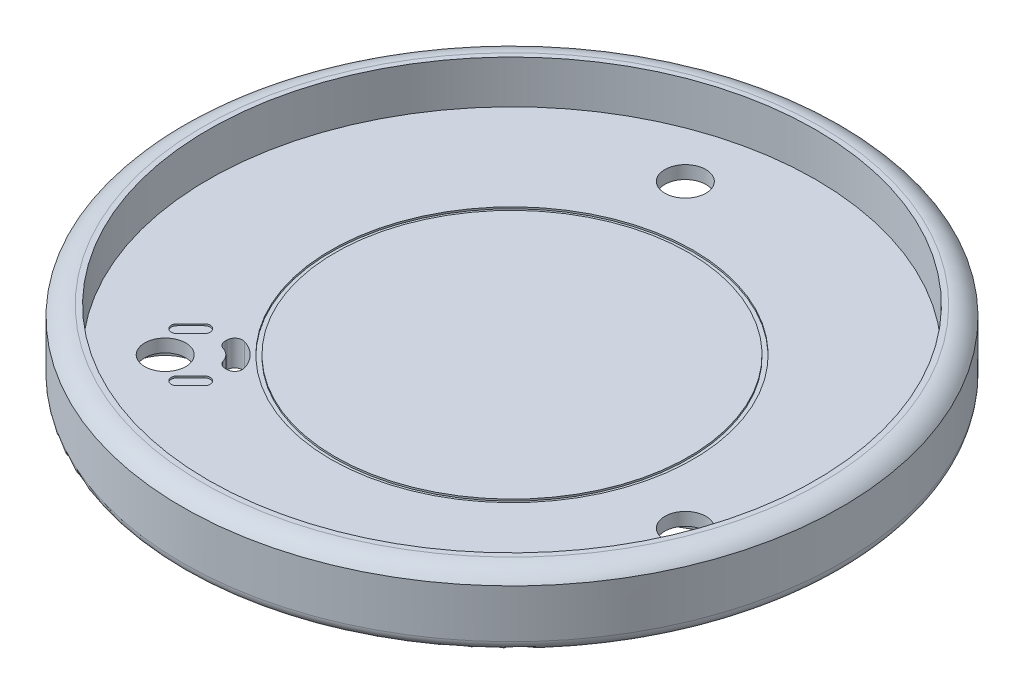
from build123d import *

# Parameters (mm, degrees)
SKETCH_1_R          = 35.2
EXTRUDE_1_DEPTH     = 3
SKETCH_3_R          = 38.2
SKETCH_3_R_2        = 35.2
EXTRUDE_2_DEPTH     = 8
SKETCH_4_R          = 21
SKETCH_4_R_2        = 20.5
CUT_EXTRUDE_1_DEPTH = 0.2
FILLET_2_R          = 1.2
CUT_EXTRUDE_2_DEPTH = 1.5
CUT_EXTRUDE_3_DEPTH = 10
CUT_EXTRUDE_4_DEPTH = 0.2
SKETCH_9_R          = 2.38
CUT_EXTRUDE_5_DEPTH = 10
CUT_EXTRUDE_6_DEPTH = 0.8


with BuildPart() as part:
    # 草图1 → 凸台-拉伸1 (new body)
    with BuildSketch(Plane(origin=(0, 0, 0), x_dir=(1, 0, 0), z_dir=(0, 1, 0))):
        with Locations(Location((0, 0, 0), (0, 0, 270))):
            Circle(SKETCH_1_R)
    extrude(amount=EXTRUDE_1_DEPTH)

    # 草图3 → 凸台-拉伸2 (add)
    with BuildSketch(Plane.XZ):
        with Locations(Location((0, 0, 0), (0, 0, 270))):
            Circle(SKETCH_3_R)
        with Locations(Location((0, 0, 0), (0, 0, 270))):
            Circle(SKETCH_3_R_2, mode=Mode.SUBTRACT)
    extrude(amount=-EXTRUDE_2_DEPTH)

    # 草图4 → 切除-拉伸1 (cut)
    with BuildSketch(Plane(origin=(0, 3, 0), x_dir=(1, 0, 0), z_dir=(0, 1, 0))):
        with Locations(Location((0, 0, 0), (0, 0, 270))):
            Circle(SKETCH_4_R)
        with Locations(Location((0, 0, 0), (0, 0, 270))):
            Circle(SKETCH_4_R_2, mode=Mode.SUBTRACT)
    extrude(amount=-CUT_EXTRUDE_1_DEPTH, mode=Mode.SUBTRACT)

    # 草图5 → 切除-旋转1 (revolve, cut)
    with BuildSketch(Plane(origin=(0, 0, 0), x_dir=(0, 0, -1), z_dir=(1, 0, 0))):
        with BuildLine():
            Line((38.2, 6.8), (38.2, 8))
            Line((38.2, 8), (35.8, 8))
            ThreePointArc((35.8, 8), (37.141640786, 7.683281573), (38.2, 6.8))
        make_face()
    revolve(axis=Axis((0, 0, 0), (0, 1, 0)), mode=Mode.SUBTRACT)

    # 圆角2
    fillet_2_edges = [part.edges().sort_by_distance(p)[0] for p in [
        (0, 0, 38.2),
    ]]
    fillet(fillet_2_edges, radius=FILLET_2_R)

    # 草图6 → 切除-拉伸2 (cut)
    with BuildSketch(Plane.XZ):
        with BuildLine():
            Line((-7.784609691, -34.516660498), (-7.091789368, -34.116660498))
            Line((-7.091789368, -34.116660498), (-3.986078552, -29.842016281))
            ThreePointArc((-3.986078552, -29.842016281), (-3.22762839, -27.700219097), (-3.758044914, -25.490875272))
            Line((-3.758044914, -25.490875272), (-4.856406461, -23.588457268))
            ThreePointArc((-4.856406461, -23.588457268), (-6.070819178, -22.656605616), (-7.588457268, -22.856406461))
            Line((-7.588457268, -22.856406461), (-9.490875272, -23.954768007))
            ThreePointArc((-9.490875272, -23.954768007), (-11.054901368, -25.602907623), (-11.468962853, -27.836983475))
            Line((-11.468962853, -27.836983475), (-10.916660498, -33.091789368))
            Line((-10.916660498, -33.091789368), (-10.516660498, -33.784609691))
            ThreePointArc((-10.516660498, -33.784609691), (-9.302247781, -34.716461343), (-7.784609691, -34.516660498))
        make_face()
        with BuildLine():
            Line((33.784609691, 10.516660498), (33.091789368, 10.916660498))
            Line((33.091789368, 10.916660498), (27.836983475, 11.468962853))
            ThreePointArc((27.836983475, 11.468962853), (25.602907623, 11.054901368), (23.954768007, 9.490875272))
            Line((23.954768007, 9.490875272), (22.856406461, 7.588457268))
            ThreePointArc((22.856406461, 7.588457268), (22.656605616, 6.070819178), (23.588457268, 4.856406461))
            Line((23.588457268, 4.856406461), (25.490875272, 3.758044914))
            ThreePointArc((25.490875272, 3.758044914), (27.700219097, 3.22762839), (29.842016281, 3.986078552))
            Line((29.842016281, 3.986078552), (34.116660498, 7.091789368))
            Line((34.116660498, 7.091789368), (34.516660498, 7.784609691))
            ThreePointArc((34.516660498, 7.784609691), (34.716461343, 9.302247781), (33.784609691, 10.516660498))
        make_face()
        with BuildLine():
            Line((-26, 24), (-26, 23.2))
            Line((-26, 23.2), (-23.850904924, 18.373053428))
            ThreePointArc((-23.850904924, 18.373053428), (-22.375279233, 16.645317728), (-20.196723093, 16))
            Line((-20.196723093, 16), (-18, 16))
            ThreePointArc((-18, 16), (-16.585786438, 16.585786438), (-16, 18))
            Line((-16, 18), (-16, 20.196723093))
            ThreePointArc((-16, 20.196723093), (-16.645317728, 22.375279233), (-18.373053428, 23.850904924))
            Line((-18.373053428, 23.850904924), (-23.2, 26))
            Line((-23.2, 26), (-24, 26))
            ThreePointArc((-24, 26), (-25.414213562, 25.414213562), (-26, 24))
        make_face()
    extrude(amount=-CUT_EXTRUDE_2_DEPTH, mode=Mode.SUBTRACT)

    # 草图7 → 切除-拉伸3 (cut)
    with BuildSketch(Plane.XZ):
        with BuildLine():
            Line((-18, 15.033520605), (-18, 15.24319025))
            ThreePointArc((-18, 15.24319025), (-17.828484492, 15.771688447), (-17.379310345, 16.098751896))
            ThreePointArc((-17.379310345, 16.098751896), (-16.585786438, 16.585786438), (-16.098751896, 17.379310345))
            ThreePointArc((-16.098751896, 17.379310345), (-15.771688447, 17.828484492), (-15.24319025, 18))
            Line((-15.24319025, 18), (-15.033520605, 18))
            ThreePointArc((-15.033520605, 18), (-14.310623209, 17.636115057), (-14.172284652, 16.838709677))
            ThreePointArc((-14.172284652, 16.838709677), (-15.171572875, 15.171572875), (-16.838709677, 14.172284652))
            ThreePointArc((-16.838709677, 14.172284652), (-17.636115057, 14.310623209), (-18, 15.033520605))
        make_face()
    extrude(amount=-CUT_EXTRUDE_3_DEPTH, mode=Mode.SUBTRACT)

    # 草图8 → 切除-拉伸4 (cut)
    with BuildSketch(Plane(origin=(0, 3, 0), x_dir=(1, 0, 0), z_dir=(0, 1, 0))):
        with BuildLine():
            ThreePointArc((-20.952735217, -14.730195543), (-19.962785724, -14.730195543), (-19.962785724, -15.720145037))
            Line((-19.962785724, -15.720145037), (-21.518420642, -17.275779955))
            ThreePointArc((-21.518420642, -17.275779955), (-22.508370136, -17.275779955), (-22.508370136, -16.285830462))
            Line((-22.508370136, -16.285830462), (-20.952735217, -14.730195543))
        make_face()
        with BuildLine():
            Line((-16.285830462, -22.508370136), (-14.730195543, -20.952735217))
            ThreePointArc((-14.730195543, -20.952735217), (-14.730195543, -19.962785724), (-15.720145037, -19.962785724))
            Line((-15.720145037, -19.962785724), (-17.275779955, -21.518420642))
            ThreePointArc((-17.275779955, -21.518420642), (-17.275779955, -22.508370136), (-16.285830462, -22.508370136))
        make_face()
    extrude(amount=-CUT_EXTRUDE_4_DEPTH, mode=Mode.SUBTRACT)

    # 草图9 → 切除-拉伸5 (cut)
    with BuildSketch(Plane(origin=(0, 3, 0), x_dir=(1, 0, 0), z_dir=(0, 1, 0))):
        with Locations(Location((-20.098361546, -20.098361546, 0), (0, 0, 270))):
            Circle(SKETCH_9_R)
        with Locations(Location((-7.3565109, 27.454872447, 0), (0, 0, 270))):
            Circle(SKETCH_9_R)
        with Locations(Location((27.454872447, -7.3565109, 0), (0, 0, 270))):
            Circle(SKETCH_9_R)
    extrude(amount=-CUT_EXTRUDE_5_DEPTH, mode=Mode.SUBTRACT)

    # 草图10 → 切除-拉伸6 (cut)
    # profile 1 of 3: a face of its own
    with BuildSketch(Plane.XZ):
        with BuildLine():
            add(Edge.make_bspline(
                [(-10.079356338, 4.867216538), (-10.179952666, 4.772388159), (-10.375534584, 4.588020433), (-10.693851774, 4.355659746), (-11.022996283, 4.174329259), (-11.360096894, 4.043494065), (-11.700654105, 3.960920857), (-12.041832646, 3.931370423), (-12.381629428, 3.948645726), (-12.718459147, 4.016200632), (-13.049190472, 4.132553617), (-13.367421854, 4.301450609), (-13.677446691, 4.514293305), (-13.863268286, 4.690466362), (-13.958848525, 4.781083725)],
                knots=[0, 0, 0, 0, 1.136115981, 2.208865351, 3.231062099, 4.218092323, 5.174148399, 6.102954762, 7.024583534, 7.962990089, 8.918560302, 9.897073085, 10.918326705, 12, 12, 12, 12], degree=3))
            Line((-13.958848525, 4.781083725), (-16.69048915, 7.51272435))
            add(Edge.make_bspline(
                [(-16.69048915, 7.51272435), (-16.781106513, 7.608304589), (-16.957279571, 7.794126185), (-17.170122266, 8.104151021), (-17.339019259, 8.422382404), (-17.455372243, 8.753113729), (-17.52292715, 9.089943447), (-17.540202452, 9.429740229), (-17.510652018, 9.770918771), (-17.42807881, 10.111475981), (-17.297243616, 10.448576593), (-17.115913129, 10.777721101), (-16.883552443, 11.096038291), (-16.699184716, 11.29162021), (-16.604356338, 11.392216538)],
                knots=[0, 0, 0, 0, 1.081673295, 2.102926915, 3.081439698, 4.037009911, 4.975416466, 5.897045238, 6.825851601, 7.781907677, 8.768937901, 9.791134649, 10.863884019, 12, 12, 12, 12], degree=3))
            add(Edge.make_bspline(
                [(-16.604356338, 11.392216538), (-16.503304185, 11.487801528), (-16.307654295, 11.672866291), (-15.987547331, 11.903617984), (-15.659428783, 12.084731391), (-15.323155572, 12.216270207), (-14.983035171, 12.298474225), (-14.641903529, 12.328022795), (-14.302012057, 12.310984095), (-13.965168422, 12.242391738), (-13.632812434, 12.129583479), (-13.314609234, 11.95952146), (-13.004487435, 11.746957112), (-12.818679533, 11.570744745), (-12.723106338, 11.480107163)],
                knots=[0, 0, 0, 0, 1.142688929, 2.212391883, 3.234380344, 4.216718667, 5.172579933, 6.101197039, 7.022638017, 7.960853358, 8.919188188, 9.897501586, 10.918547111, 12, 12, 12, 12], degree=3))
            Line((-12.723106338, 11.480107163), (-9.991465713, 8.748466538))
            add(Edge.make_bspline(
                [(-9.991465713, 8.748466538), (-9.90082813, 8.652893342), (-9.724615764, 8.46708544), (-9.512051415, 8.156963641), (-9.341989396, 7.838760441), (-9.229181137, 7.506404453), (-9.160588781, 7.169560818), (-9.14355008, 6.829669346), (-9.17309865, 6.488537705), (-9.255302668, 6.148417303), (-9.386841484, 5.812144092), (-9.567954891, 5.484025544), (-9.798706584, 5.16391858), (-9.983771348, 4.968268691), (-10.079356338, 4.867216538)],
                knots=[0, 0, 0, 0, 1.081452889, 2.102498414, 3.080811812, 4.039146642, 4.977361983, 5.898802961, 6.827420067, 7.783281333, 8.765619656, 9.787608117, 10.857311071, 12, 12, 12, 12], degree=3))
        make_face()
        with BuildLine():
            add(Edge.make_bspline(
                [(-11.019786025, 5.807646225), (-10.98473469, 5.844703326), (-10.916164343, 5.91719752), (-10.823640946, 6.031046135), (-10.747945889, 6.15033688), (-10.684794341, 6.270784792), (-10.634164269, 6.393512619), (-10.599669779, 6.519368035), (-10.575473476, 6.647498251), (-10.569865043, 6.777952375), (-10.57432649, 6.908088154), (-10.593614457, 7.036732155), (-10.627875016, 7.161815293), (-10.672815734, 7.284746603), (-10.736292742, 7.402336876), (-10.809586417, 7.519055721), (-10.898468045, 7.632248484), (-10.965861347, 7.703112251), (-11.000450088, 7.739482163)],
                knots=[0, 0, 0, 0, 1.123174975, 2.197248608, 3.224495634, 4.228712617, 5.189549244, 6.14133267, 7.098088556, 8.054322242, 9.009946336, 9.962516613, 10.910882808, 11.862316313, 12.837685189, 13.847111187, 14.895057655, 16, 16, 16, 16], degree=3))
            Line((-11.000450088, 7.739482163), (-13.732090713, 10.471122788))
            add(Edge.make_bspline(
                [(-13.732090713, 10.471122788), (-13.768406192, 10.505799239), (-13.839163901, 10.573363437), (-13.952974526, 10.66092342), (-14.066614635, 10.738339199), (-14.186055372, 10.797871855), (-14.307797815, 10.845547196), (-14.432294648, 10.881800654), (-14.56002391, 10.900028173), (-14.68889703, 10.907785679), (-14.818035153, 10.900700943), (-14.945958652, 10.879433721), (-15.071374739, 10.843783333), (-15.195612662, 10.794665061), (-15.316219789, 10.728189825), (-15.437079192, 10.651543534), (-15.55260447, 10.55712933), (-15.626278359, 10.487412854), (-15.66392665, 10.45178685)],
                knots=[0, 0, 0, 0, 1.102832843, 2.148778623, 3.152483981, 4.120095036, 5.074329331, 6.024295658, 6.962314458, 7.903862974, 8.858271066, 9.798321073, 10.7482874, 11.719235203, 12.727556838, 13.770644404, 14.860771026, 16, 16, 16, 16], degree=3))
            add(Edge.make_bspline(
                [(-15.66392665, 10.45178685), (-15.69957054, 10.414147507), (-15.769322019, 10.340491129), (-15.863485966, 10.224840658), (-15.940876674, 10.104658818), (-16.004199159, 9.982535906), (-16.056517891, 9.859727394), (-16.091388124, 9.73374831), (-16.112942734, 9.605904763), (-16.119702741, 9.476791598), (-16.112938444, 9.34764753), (-16.091139335, 9.221227996), (-16.058532719, 9.096165826), (-16.007608422, 8.976137522), (-15.948928807, 8.85615729), (-15.871246645, 8.742613867), (-15.783761317, 8.628776146), (-15.716186616, 8.558022248), (-15.681504775, 8.521708725)],
                knots=[0, 0, 0, 0, 1.139956555, 2.230779399, 3.274533144, 4.277473055, 5.253900326, 6.204473361, 7.14512374, 8.100141376, 9.042291223, 9.982941603, 10.917658897, 11.877273619, 12.84550265, 13.849849036, 14.896462821, 16, 16, 16, 16], degree=3))
            Line((-15.681504775, 8.521708725), (-12.94986415, 5.7900681))
            add(Edge.make_bspline(
                [(-12.94986415, 5.7900681), (-12.913494298, 5.755478979), (-12.842630649, 5.688084935), (-12.72943705, 5.599208589), (-12.6127212, 5.525895982), (-12.495120272, 5.462486353), (-12.372227476, 5.417302077), (-12.24747227, 5.384069929), (-12.119859838, 5.361420025), (-11.990057725, 5.357922092), (-11.859656032, 5.363301311), (-11.731470465, 5.387462437), (-11.605259501, 5.422471555), (-11.481902104, 5.471721392), (-11.362198976, 5.536405282), (-11.243140221, 5.611410082), (-11.129349581, 5.704048969), (-11.056847274, 5.772603152), (-11.019786025, 5.807646225)],
                knots=[0, 0, 0, 0, 1.105645508, 2.154258869, 3.164327246, 4.140316827, 5.092355806, 6.041325522, 6.983773033, 7.940005267, 8.896847481, 9.854212228, 10.80660135, 11.780025458, 12.773452361, 13.801353106, 14.876110259, 16, 16, 16, 16], degree=3))
        make_face(mode=Mode.SUBTRACT)
    # profile 2 of 3: a face of its own
    with BuildSketch(Plane.XZ):
        with BuildLine():
            add(Edge.make_bspline(
                [(-12.779356338, 7.567216538), (-12.821974949, 7.527992427), (-12.903736257, 7.45274327), (-13.043998221, 7.370961913), (-13.188922028, 7.316975696), (-13.340065898, 7.299784972), (-13.491929993, 7.315862892), (-13.640922547, 7.366441163), (-13.784790754, 7.454074096), (-13.869960047, 7.53273765), (-13.914903213, 7.574247788)],
                knots=[0, 0, 0, 0, 1.078468522, 2.068978668, 3.010058665, 3.94623103, 4.881188457, 5.839340878, 6.859837199, 8, 8, 8, 8], degree=3))
            add(Edge.make_bspline(
                [(-13.914903213, 7.574247788), (-13.955951752, 7.618541183), (-14.03404063, 7.702802926), (-14.11828669, 7.845829791), (-14.168472451, 7.991815823), (-14.18120286, 8.140995248), (-14.156713285, 8.28832961), (-14.102603835, 8.431371538), (-14.01847208, 8.569153861), (-13.943409568, 8.650101445), (-13.904356338, 8.692216538)],
                knots=[0, 0, 0, 0, 1.139675049, 2.168066075, 3.114402787, 4.037609751, 4.968766405, 5.91575196, 6.91561558, 8, 8, 8, 8], degree=3))
            add(Edge.make_bspline(
                [(-13.904356338, 8.692216538), (-13.862243556, 8.731290315), (-13.781300413, 8.806392321), (-13.6434873, 8.89025032), (-13.501180568, 8.945082922), (-13.354221392, 8.966191813), (-13.205149316, 8.956846702), (-13.0584074, 8.906369193), (-12.91495589, 8.821918905), (-12.830685518, 8.74381818), (-12.786387588, 8.702763413)],
                knots=[0, 0, 0, 0, 1.084786176, 2.085020238, 3.032356643, 3.951234827, 4.873918182, 5.831130674, 6.85990271, 8, 8, 8, 8], degree=3))
            add(Edge.make_bspline(
                [(-12.786387588, 8.702763413), (-12.744877361, 8.657817276), (-12.666213638, 8.572642351), (-12.578290451, 8.428333959), (-12.527711566, 8.27865688), (-12.51405244, 8.126586462), (-12.531479619, 7.976632831), (-12.582621019, 7.831469363), (-12.665046618, 7.691658532), (-12.740188267, 7.609856419), (-12.779356338, 7.567216538)],
                knots=[0, 0, 0, 0, 1.140905902, 2.162067331, 3.131221777, 4.065699465, 4.991612349, 5.929672876, 6.920828586, 8, 8, 8, 8], degree=3))
        make_face()
    # profile 3 of 3: a face of its own
    with BuildSketch(Plane.XZ):
        Polygon((-6.234028625, 8.93754425), (-9.311958313, 16.578755188), (-11.303559875, 14.587153625), (-10.275239563, 13.558833313), (-11.343989563, 12.490083313), (-13.312739563, 14.458833313), (-9.097505188, 18.674067688), (-8.1570755, 17.733638), (-5.0633255, 10.108247375), align=None)
    extrude(amount=-CUT_EXTRUDE_6_DEPTH, mode=Mode.SUBTRACT)


solid = part.part
